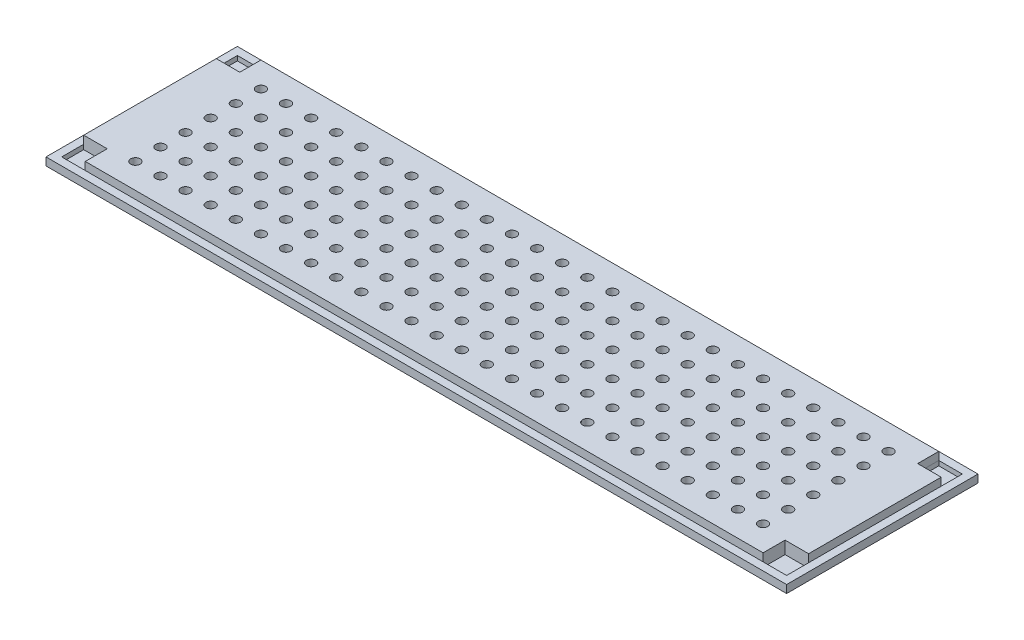
from build123d import *

# Parameters (mm, degrees)
SKETCH1_W           = 236
SKETCH1_H           = 60.98
BOSS_EXTRUDE2_DEPTH = 2.5
BOSS_EXTRUDE3_DEPTH = 2.5
SKETCH4_W           = 7.502299771
SKETCH4_H           = 6.733304844
CUT_EXTRUDE2_DEPTH  = 1.5
SKETCH5_R           = 1.5
CUT_EXTRUDE3_DEPTH  = 10


with BuildPart() as part:
    # Sketch1 → Boss-Extrude2 (new body)
    with BuildSketch(Plane(origin=(0, 0, 0), x_dir=(1, 0, 0), z_dir=(0, 1, 0))):
        Rectangle(SKETCH1_W, SKETCH1_H)
    extrude(amount=BOSS_EXTRUDE2_DEPTH)

    # Sketch2 → Boss-Extrude3 (add)
    with BuildSketch(Plane(origin=(0, 2.5, 0), x_dir=(1, 0, 0), z_dir=(0, 1, 0))):
        Polygon((-107.997700229, 27.99), (-107.997700229, 21.256695156), (-115.5, 21.256695156), (-115.5, -20.985887641), (-107.997700229, -20.985887641), (-107.997700229, -27.985887641), (107.997700229, -27.985887641), (107.997700229, -20.985887641), (115.5, -20.985887641), (115.5, 21.256695156), (108, 21.258101333), (107.997700229, 27.99), align=None)
    extrude(amount=BOSS_EXTRUDE3_DEPTH)

    # Sketch4 → Cut-Extrude2 (cut)
    with BuildSketch(Plane(origin=(0, 2.5, 0), x_dir=(1, 0, 0), z_dir=(0, 1, 0))):
        with Locations((-111.748850115, 24.623347578)):
            Rectangle(SKETCH4_W, SKETCH4_H)
        Polygon((-107.997700229, -21.256695156), (-107.997700229, -27.99), (-115.5, -27.99), (-115.5, -21.256695156), (-115.5, -20.985887641), (-107.997700229, -20.985887641), align=None)
        Polygon((115.5, -21.256695156), (115.5, -20.985887641), (107.997700229, -20.985887641), (107.997700229, -21.256695156), (107.997700229, -27.99), (115.5, -27.99), align=None)
        with Locations((111.748850115, 24.623347578)):
            Rectangle(SKETCH4_W, SKETCH4_H)
    extrude(amount=-CUT_EXTRUDE2_DEPTH, mode=Mode.SUBTRACT)

    # Sketch5 → Cut-Extrude3 (cut)
    with BuildSketch(Plane(origin=(0, 5, 0), x_dir=(1, 0, 0), z_dir=(0, 1, 0))):
        with Locations(Location((-99.997700229, 19.99, 0), (0, 0, 270))):
            Circle(SKETCH5_R)
        with Locations(Location((-91.997700229, 19.99, 0), (0, 0, 270))):
            Circle(SKETCH5_R)
        with Locations(Location((-83.997700229, 19.99, 0), (0, 0, 270))):
            Circle(SKETCH5_R)
        with Locations(Location((-75.997700229, 19.99, 0), (0, 0, 270))):
            Circle(SKETCH5_R)
        with Locations(Location((-67.997700229, 19.99, 0), (0, 0, 270))):
            Circle(SKETCH5_R)
        with Locations(Location((-59.997700229, 19.99, 0), (0, 0, 270))):
            Circle(SKETCH5_R)
        with Locations(Location((-51.997700229, 19.99, 0), (0, 0, 270))):
            Circle(SKETCH5_R)
        with Locations(Location((-43.997700229, 19.99, 0), (0, 0, 270))):
            Circle(SKETCH5_R)
        with Locations(Location((-35.997700229, 19.99, 0), (0, 0, 270))):
            Circle(SKETCH5_R)
        with Locations(Location((-27.997700229, 19.99, 0), (0, 0, 270))):
            Circle(SKETCH5_R)
        with Locations(Location((-19.997700229, 19.99, 0), (0, 0, 270))):
            Circle(SKETCH5_R)
        with Locations(Location((-11.997700229, 19.99, 0), (0, 0, 270))):
            Circle(SKETCH5_R)
        with Locations(Location((-3.997700229, 19.99, 0), (0, 0, 270))):
            Circle(SKETCH5_R)
        with Locations(Location((4.002299771, 19.99, 0), (0, 0, 270))):
            Circle(SKETCH5_R)
        with Locations(Location((12.002299771, 19.99, 0), (0, 0, 270))):
            Circle(SKETCH5_R)
        with Locations(Location((20.002299771, 19.99, 0), (0, 0, 270))):
            Circle(SKETCH5_R)
        with Locations(Location((28.002299771, 19.99, 0), (0, 0, 270))):
            Circle(SKETCH5_R)
        with Locations(Location((36.002299771, 19.99, 0), (0, 0, 270))):
            Circle(SKETCH5_R)
        with Locations(Location((44.002299771, 19.99, 0), (0, 0, 270))):
            Circle(SKETCH5_R)
        with Locations(Location((52.002299771, 19.99, 0), (0, 0, 270))):
            Circle(SKETCH5_R)
        with Locations(Location((60.002299771, 19.99, 0), (0, 0, 270))):
            Circle(SKETCH5_R)
        with Locations(Location((68.002299771, 19.99, 0), (0, 0, 270))):
            Circle(SKETCH5_R)
        with Locations(Location((76.002299771, 19.99, 0), (0, 0, 270))):
            Circle(SKETCH5_R)
        with Locations(Location((84.002299771, 19.99, 0), (0, 0, 270))):
            Circle(SKETCH5_R)
        with Locations(Location((92.002299771, 19.99, 0), (0, 0, 270))):
            Circle(SKETCH5_R)
        with Locations(Location((100.002299771, 19.99, 0), (0, 0, 270))):
            Circle(SKETCH5_R)
        with Locations(Location((-91.997700229, 11.99, 0), (0, 0, 270))):
            Circle(SKETCH5_R)
        with Locations(Location((-83.997700229, 11.99, 0), (0, 0, 270))):
            Circle(SKETCH5_R)
        with Locations(Location((-75.997700229, 11.99, 0), (0, 0, 270))):
            Circle(SKETCH5_R)
        with Locations(Location((-67.997700229, 11.99, 0), (0, 0, 270))):
            Circle(SKETCH5_R)
        with Locations(Location((-59.997700229, 11.99, 0), (0, 0, 270))):
            Circle(SKETCH5_R)
        with Locations(Location((-51.997700229, 11.99, 0), (0, 0, 270))):
            Circle(SKETCH5_R)
        with Locations(Location((-43.997700229, 11.99, 0), (0, 0, 270))):
            Circle(SKETCH5_R)
        with Locations(Location((-35.997700229, 11.99, 0), (0, 0, 270))):
            Circle(SKETCH5_R)
        with Locations(Location((-27.997700229, 11.99, 0), (0, 0, 270))):
            Circle(SKETCH5_R)
        with Locations(Location((-19.997700229, 11.99, 0), (0, 0, 270))):
            Circle(SKETCH5_R)
        with Locations(Location((-11.997700229, 11.99, 0), (0, 0, 270))):
            Circle(SKETCH5_R)
        with Locations(Location((-3.997700229, 11.99, 0), (0, 0, 270))):
            Circle(SKETCH5_R)
        with Locations(Location((4.002299771, 11.99, 0), (0, 0, 270))):
            Circle(SKETCH5_R)
        with Locations(Location((12.002299771, 11.99, 0), (0, 0, 270))):
            Circle(SKETCH5_R)
        with Locations(Location((20.002299771, 11.99, 0), (0, 0, 270))):
            Circle(SKETCH5_R)
        with Locations(Location((28.002299771, 11.99, 0), (0, 0, 270))):
            Circle(SKETCH5_R)
        with Locations(Location((36.002299771, 11.99, 0), (0, 0, 270))):
            Circle(SKETCH5_R)
        with Locations(Location((44.002299771, 11.99, 0), (0, 0, 270))):
            Circle(SKETCH5_R)
        with Locations(Location((52.002299771, 11.99, 0), (0, 0, 270))):
            Circle(SKETCH5_R)
        with Locations(Location((60.002299771, 11.99, 0), (0, 0, 270))):
            Circle(SKETCH5_R)
        with Locations(Location((68.002299771, 11.99, 0), (0, 0, 270))):
            Circle(SKETCH5_R)
        with Locations(Location((76.002299771, 11.99, 0), (0, 0, 270))):
            Circle(SKETCH5_R)
        with Locations(Location((84.002299771, 11.99, 0), (0, 0, 270))):
            Circle(SKETCH5_R)
        with Locations(Location((92.002299771, 11.99, 0), (0, 0, 270))):
            Circle(SKETCH5_R)
        with Locations(Location((100.002299771, 11.99, 0), (0, 0, 270))):
            Circle(SKETCH5_R)
        with Locations(Location((-91.997700229, 3.99, 0), (0, 0, 270))):
            Circle(SKETCH5_R)
        with Locations(Location((-83.997700229, 3.99, 0), (0, 0, 270))):
            Circle(SKETCH5_R)
        with Locations(Location((-75.997700229, 3.99, 0), (0, 0, 270))):
            Circle(SKETCH5_R)
        with Locations(Location((-67.997700229, 3.99, 0), (0, 0, 270))):
            Circle(SKETCH5_R)
        with Locations(Location((-59.997700229, 3.99, 0), (0, 0, 270))):
            Circle(SKETCH5_R)
        with Locations(Location((-51.997700229, 3.99, 0), (0, 0, 270))):
            Circle(SKETCH5_R)
        with Locations(Location((-43.997700229, 3.99, 0), (0, 0, 270))):
            Circle(SKETCH5_R)
        with Locations(Location((-35.997700229, 3.99, 0), (0, 0, 270))):
            Circle(SKETCH5_R)
        with Locations(Location((-27.997700229, 3.99, 0), (0, 0, 270))):
            Circle(SKETCH5_R)
        with Locations(Location((-19.997700229, 3.99, 0), (0, 0, 270))):
            Circle(SKETCH5_R)
        with Locations(Location((-11.997700229, 3.99, 0), (0, 0, 270))):
            Circle(SKETCH5_R)
        with Locations(Location((-3.997700229, 3.99, 0), (0, 0, 270))):
            Circle(SKETCH5_R)
        with Locations(Location((4.002299771, 3.99, 0), (0, 0, 270))):
            Circle(SKETCH5_R)
        with Locations(Location((12.002299771, 3.99, 0), (0, 0, 270))):
            Circle(SKETCH5_R)
        with Locations(Location((20.002299771, 3.99, 0), (0, 0, 270))):
            Circle(SKETCH5_R)
        with Locations(Location((28.002299771, 3.99, 0), (0, 0, 270))):
            Circle(SKETCH5_R)
        with Locations(Location((36.002299771, 3.99, 0), (0, 0, 270))):
            Circle(SKETCH5_R)
        with Locations(Location((44.002299771, 3.99, 0), (0, 0, 270))):
            Circle(SKETCH5_R)
        with Locations(Location((52.002299771, 3.99, 0), (0, 0, 270))):
            Circle(SKETCH5_R)
        with Locations(Location((60.002299771, 3.99, 0), (0, 0, 270))):
            Circle(SKETCH5_R)
        with Locations(Location((68.002299771, 3.99, 0), (0, 0, 270))):
            Circle(SKETCH5_R)
        with Locations(Location((76.002299771, 3.99, 0), (0, 0, 270))):
            Circle(SKETCH5_R)
        with Locations(Location((84.002299771, 3.99, 0), (0, 0, 270))):
            Circle(SKETCH5_R)
        with Locations(Location((92.002299771, 3.99, 0), (0, 0, 270))):
            Circle(SKETCH5_R)
        with Locations(Location((100.002299771, 3.99, 0), (0, 0, 270))):
            Circle(SKETCH5_R)
        with Locations(Location((-91.997700229, -4.01, 0), (0, 0, 270))):
            Circle(SKETCH5_R)
        with Locations(Location((-83.997700229, -4.01, 0), (0, 0, 270))):
            Circle(SKETCH5_R)
        with Locations(Location((-75.997700229, -4.01, 0), (0, 0, 270))):
            Circle(SKETCH5_R)
        with Locations(Location((-67.997700229, -4.01, 0), (0, 0, 270))):
            Circle(SKETCH5_R)
        with Locations(Location((-59.997700229, -4.01, 0), (0, 0, 270))):
            Circle(SKETCH5_R)
        with Locations(Location((-51.997700229, -4.01, 0), (0, 0, 270))):
            Circle(SKETCH5_R)
        with Locations(Location((-43.997700229, -4.01, 0), (0, 0, 270))):
            Circle(SKETCH5_R)
        with Locations(Location((-35.997700229, -4.01, 0), (0, 0, 270))):
            Circle(SKETCH5_R)
        with Locations(Location((-27.997700229, -4.01, 0), (0, 0, 270))):
            Circle(SKETCH5_R)
        with Locations(Location((-19.997700229, -4.01, 0), (0, 0, 270))):
            Circle(SKETCH5_R)
        with Locations(Location((-11.997700229, -4.01, 0), (0, 0, 270))):
            Circle(SKETCH5_R)
        with Locations(Location((-3.997700229, -4.01, 0), (0, 0, 270))):
            Circle(SKETCH5_R)
        with Locations(Location((4.002299771, -4.01, 0), (0, 0, 270))):
            Circle(SKETCH5_R)
        with Locations(Location((12.002299771, -4.01, 0), (0, 0, 270))):
            Circle(SKETCH5_R)
        with Locations(Location((20.002299771, -4.01, 0), (0, 0, 270))):
            Circle(SKETCH5_R)
        with Locations(Location((28.002299771, -4.01, 0), (0, 0, 270))):
            Circle(SKETCH5_R)
        with Locations(Location((36.002299771, -4.01, 0), (0, 0, 270))):
            Circle(SKETCH5_R)
        with Locations(Location((44.002299771, -4.01, 0), (0, 0, 270))):
            Circle(SKETCH5_R)
        with Locations(Location((52.002299771, -4.01, 0), (0, 0, 270))):
            Circle(SKETCH5_R)
        with Locations(Location((60.002299771, -4.01, 0), (0, 0, 270))):
            Circle(SKETCH5_R)
        with Locations(Location((68.002299771, -4.01, 0), (0, 0, 270))):
            Circle(SKETCH5_R)
        with Locations(Location((76.002299771, -4.01, 0), (0, 0, 270))):
            Circle(SKETCH5_R)
        with Locations(Location((84.002299771, -4.01, 0), (0, 0, 270))):
            Circle(SKETCH5_R)
        with Locations(Location((92.002299771, -4.01, 0), (0, 0, 270))):
            Circle(SKETCH5_R)
        with Locations(Location((100.002299771, -4.01, 0), (0, 0, 270))):
            Circle(SKETCH5_R)
        with Locations(Location((-91.997700229, -12.01, 0), (0, 0, 270))):
            Circle(SKETCH5_R)
        with Locations(Location((-83.997700229, -12.01, 0), (0, 0, 270))):
            Circle(SKETCH5_R)
        with Locations(Location((-75.997700229, -12.01, 0), (0, 0, 270))):
            Circle(SKETCH5_R)
        with Locations(Location((-67.997700229, -12.01, 0), (0, 0, 270))):
            Circle(SKETCH5_R)
        with Locations(Location((-59.997700229, -12.01, 0), (0, 0, 270))):
            Circle(SKETCH5_R)
        with Locations(Location((-51.997700229, -12.01, 0), (0, 0, 270))):
            Circle(SKETCH5_R)
        with Locations(Location((-43.997700229, -12.01, 0), (0, 0, 270))):
            Circle(SKETCH5_R)
        with Locations(Location((-35.997700229, -12.01, 0), (0, 0, 270))):
            Circle(SKETCH5_R)
        with Locations(Location((-27.997700229, -12.01, 0), (0, 0, 270))):
            Circle(SKETCH5_R)
        with Locations(Location((-19.997700229, -12.01, 0), (0, 0, 270))):
            Circle(SKETCH5_R)
        with Locations(Location((-11.997700229, -12.01, 0), (0, 0, 270))):
            Circle(SKETCH5_R)
        with Locations(Location((-3.997700229, -12.01, 0), (0, 0, 270))):
            Circle(SKETCH5_R)
        with Locations(Location((4.002299771, -12.01, 0), (0, 0, 270))):
            Circle(SKETCH5_R)
        with Locations(Location((12.002299771, -12.01, 0), (0, 0, 270))):
            Circle(SKETCH5_R)
        with Locations(Location((20.002299771, -12.01, 0), (0, 0, 270))):
            Circle(SKETCH5_R)
        with Locations(Location((28.002299771, -12.01, 0), (0, 0, 270))):
            Circle(SKETCH5_R)
        with Locations(Location((36.002299771, -12.01, 0), (0, 0, 270))):
            Circle(SKETCH5_R)
        with Locations(Location((44.002299771, -12.01, 0), (0, 0, 270))):
            Circle(SKETCH5_R)
        with Locations(Location((52.002299771, -12.01, 0), (0, 0, 270))):
            Circle(SKETCH5_R)
        with Locations(Location((60.002299771, -12.01, 0), (0, 0, 270))):
            Circle(SKETCH5_R)
        with Locations(Location((68.002299771, -12.01, 0), (0, 0, 270))):
            Circle(SKETCH5_R)
        with Locations(Location((76.002299771, -12.01, 0), (0, 0, 270))):
            Circle(SKETCH5_R)
        with Locations(Location((84.002299771, -12.01, 0), (0, 0, 270))):
            Circle(SKETCH5_R)
        with Locations(Location((92.002299771, -12.01, 0), (0, 0, 270))):
            Circle(SKETCH5_R)
        with Locations(Location((100.002299771, -12.01, 0), (0, 0, 270))):
            Circle(SKETCH5_R)
        with Locations(Location((-91.997700229, -20.01, 0), (0, 0, 270))):
            Circle(SKETCH5_R)
        with Locations(Location((-83.997700229, -20.01, 0), (0, 0, 270))):
            Circle(SKETCH5_R)
        with Locations(Location((-75.997700229, -20.01, 0), (0, 0, 270))):
            Circle(SKETCH5_R)
        with Locations(Location((-67.997700229, -20.01, 0), (0, 0, 270))):
            Circle(SKETCH5_R)
        with Locations(Location((-59.997700229, -20.01, 0), (0, 0, 270))):
            Circle(SKETCH5_R)
        with Locations(Location((-51.997700229, -20.01, 0), (0, 0, 270))):
            Circle(SKETCH5_R)
        with Locations(Location((-43.997700229, -20.01, 0), (0, 0, 270))):
            Circle(SKETCH5_R)
        with Locations(Location((-35.997700229, -20.01, 0), (0, 0, 270))):
            Circle(SKETCH5_R)
        with Locations(Location((-27.997700229, -20.01, 0), (0, 0, 270))):
            Circle(SKETCH5_R)
        with Locations(Location((-19.997700229, -20.01, 0), (0, 0, 270))):
            Circle(SKETCH5_R)
        with Locations(Location((-11.997700229, -20.01, 0), (0, 0, 270))):
            Circle(SKETCH5_R)
        with Locations(Location((-3.997700229, -20.01, 0), (0, 0, 270))):
            Circle(SKETCH5_R)
        with Locations(Location((4.002299771, -20.01, 0), (0, 0, 270))):
            Circle(SKETCH5_R)
        with Locations(Location((12.002299771, -20.01, 0), (0, 0, 270))):
            Circle(SKETCH5_R)
        with Locations(Location((20.002299771, -20.01, 0), (0, 0, 270))):
            Circle(SKETCH5_R)
        with Locations(Location((28.002299771, -20.01, 0), (0, 0, 270))):
            Circle(SKETCH5_R)
        with Locations(Location((36.002299771, -20.01, 0), (0, 0, 270))):
            Circle(SKETCH5_R)
        with Locations(Location((44.002299771, -20.01, 0), (0, 0, 270))):
            Circle(SKETCH5_R)
        with Locations(Location((52.002299771, -20.01, 0), (0, 0, 270))):
            Circle(SKETCH5_R)
        with Locations(Location((60.002299771, -20.01, 0), (0, 0, 270))):
            Circle(SKETCH5_R)
        with Locations(Location((68.002299771, -20.01, 0), (0, 0, 270))):
            Circle(SKETCH5_R)
        with Locations(Location((76.002299771, -20.01, 0), (0, 0, 270))):
            Circle(SKETCH5_R)
        with Locations(Location((84.002299771, -20.01, 0), (0, 0, 270))):
            Circle(SKETCH5_R)
        with Locations(Location((92.002299771, -20.01, 0), (0, 0, 270))):
            Circle(SKETCH5_R)
        with Locations(Location((100.002299771, -20.01, 0), (0, 0, 270))):
            Circle(SKETCH5_R)
        with Locations(Location((-99.997700229, 11.99, 0), (0, 0, 270))):
            Circle(SKETCH5_R)
        with Locations(Location((-99.997700229, 3.99, 0), (0, 0, 270))):
            Circle(SKETCH5_R)
        with Locations(Location((-99.997700229, -4.01, 0), (0, 0, 270))):
            Circle(SKETCH5_R)
        with Locations(Location((-99.997700229, -12.01, 0), (0, 0, 270))):
            Circle(SKETCH5_R)
        with Locations(Location((-99.997700229, -20.01, 0), (0, 0, 270))):
            Circle(SKETCH5_R)
    extrude(amount=-CUT_EXTRUDE3_DEPTH, mode=Mode.SUBTRACT)


solid = part.part
